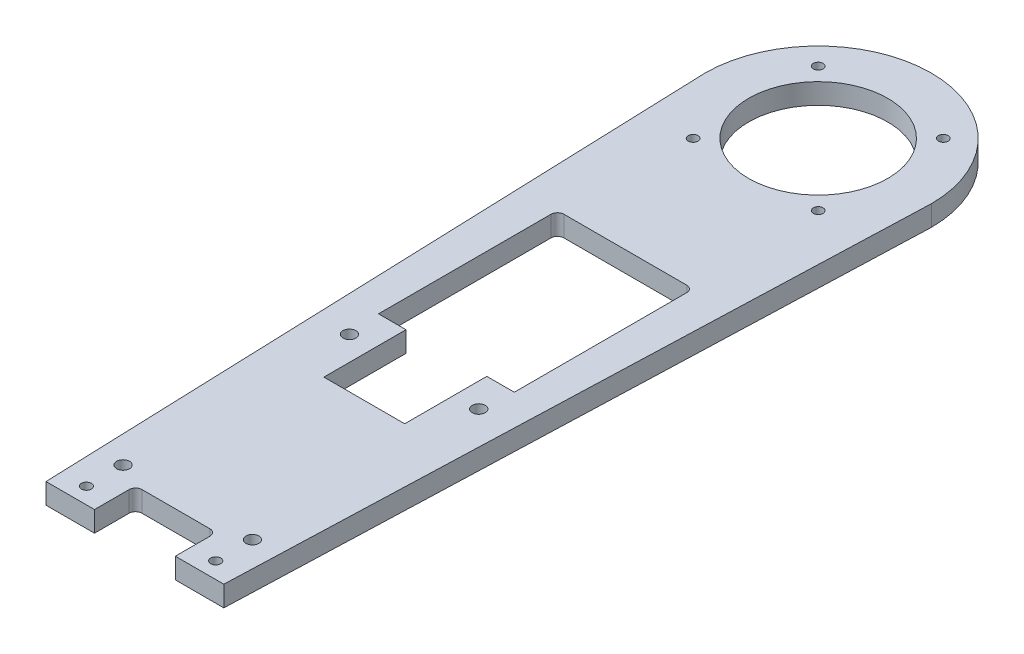
from build123d import *

# Parameters (mm, degrees)
BOSS_EXTRUDE1_DEPTH = 3.175
SKETCH2_R           = 21.5
CUT_EXTRUDE1_DEPTH  = 215.322525648
SKETCH3_W           = 42
SKETCH3_H           = 55.35
SKETCH3_W_2         = 25
SKETCH3_H_2         = 96.35
CUT_EXTRUDE2_DEPTH  = 215.322525648
SKETCH4_R           = 1.5
CUT_EXTRUDE3_DEPTH  = 215.322525648
SKETCH5_R           = 2
CUT_EXTRUDE4_DEPTH  = 215.322525648
SKETCH7_R           = 1.55
CUT_EXTRUDE6_DEPTH  = 215.322525648
SKETCH8_W           = 25
SKETCH8_H           = 58.25
BOSS_EXTRUDE2_DEPTH = 6.35
FILLET1_R           = 2


with BuildPart() as part:
    # Sketch1 → Boss-Extrude1 (new, symmetric)
    with BuildSketch(Plane(origin=(0, 0, 0), x_dir=(1, 0, 0), z_dir=(0, 1, 0))):
        with BuildLine():
            ThreePointArc((35, 0), (0, 35), (-35, 0))
            Line((-35, 0), (-27.5, -211.35))
            Line((-27.5, -211.35), (27.5, -211.35))
            Line((27.5, -211.35), (35, 0))
        make_face()
    extrude(amount=BOSS_EXTRUDE1_DEPTH, both=True)

    # Sketch2 → Cut-Extrude1 (cut, through all)
    with BuildSketch(Plane(origin=(0, 3.175, 0), x_dir=(1, 0, 0), z_dir=(0, 1, 0))):
        with Locations(Location((0, 0, 0), (0, 0, 270))):
            Circle(SKETCH2_R)
    extrude(amount=-CUT_EXTRUDE1_DEPTH, mode=Mode.SUBTRACT)

    # Sketch3 → Cut-Extrude2 (cut, through all)
    with BuildSketch(Plane(origin=(0, 3.175, 0), x_dir=(1, 0, 0), z_dir=(0, 1, 0))):
        with Locations((0, -87.325)):
            Rectangle(SKETCH3_W, SKETCH3_H)
        with Locations((0, -163.175)):
            Rectangle(SKETCH3_W_2, SKETCH3_H_2)
    extrude(amount=-CUT_EXTRUDE2_DEPTH, mode=Mode.SUBTRACT)

    # Sketch4 → Cut-Extrude3 (cut, through all)
    with BuildSketch(Plane(origin=(0, 3.175, 0), x_dir=(1, 0, 0), z_dir=(0, 1, 0))):
        with Locations(Location((-19.35, 19.35, 0), (0, 0, 270))):
            Circle(SKETCH4_R)
        with Locations(Location((19.35, 19.35, 0), (0, 0, 270))):
            Circle(SKETCH4_R)
        with Locations(Location((19.35, -19.35, 0), (0, 0, 270))):
            Circle(SKETCH4_R)
        with Locations(Location((-19.35, -19.35, 0), (0, 0, 270))):
            Circle(SKETCH4_R)
    extrude(amount=-CUT_EXTRUDE3_DEPTH, mode=Mode.SUBTRACT)

    # Sketch5 → Cut-Extrude4 (cut, through all)
    with BuildSketch(Plane(origin=(0, 3.175, 0), x_dir=(1, 0, 0), z_dir=(0, 1, 0))):
        with Locations(Location((-20, -195, 0), (0, 0, 270))):
            Circle(SKETCH5_R)
        with Locations(Location((20, -195, 0), (0, 0, 270))):
            Circle(SKETCH5_R)
        with Locations(Location((20, -125, 0), (0, 0, 90))):
            Circle(SKETCH5_R)
        with Locations(Location((-20, -125, 0), (0, 0, 90))):
            Circle(SKETCH5_R)
    extrude(amount=-CUT_EXTRUDE4_DEPTH, mode=Mode.SUBTRACT)

    # Sketch7 → Cut-Extrude6 (cut, through all)
    with BuildSketch(Plane.XZ.offset(3.175)):
        with Locations(Location((-20, 206.35, 0), (0, 0, 270))):
            Circle(SKETCH7_R)
        with Locations(Location((20, 206.35, 0), (0, 0, 270))):
            Circle(SKETCH7_R)
    extrude(amount=-CUT_EXTRUDE6_DEPTH, mode=Mode.SUBTRACT)

    # Sketch8 → Boss-Extrude2 (add)
    with BuildSketch(Plane(origin=(0, 3.175, 0), x_dir=(1, 0, 0), z_dir=(0, 1, 0))):
        with Locations((0, -169.525)):
            Rectangle(SKETCH8_W, SKETCH8_H)
    extrude(amount=-BOSS_EXTRUDE2_DEPTH)

    # Fillet1
    fillet1_edges = [part.edges().sort_by_distance(p)[0] for p in [
        (-12.5, 0, 198.65),
        (12.5, 0, 198.65),
        (-21, 0, 59.65),
        (21, 0, 59.65),
    ]]
    fillet(fillet1_edges, radius=FILLET1_R)


solid = part.part
